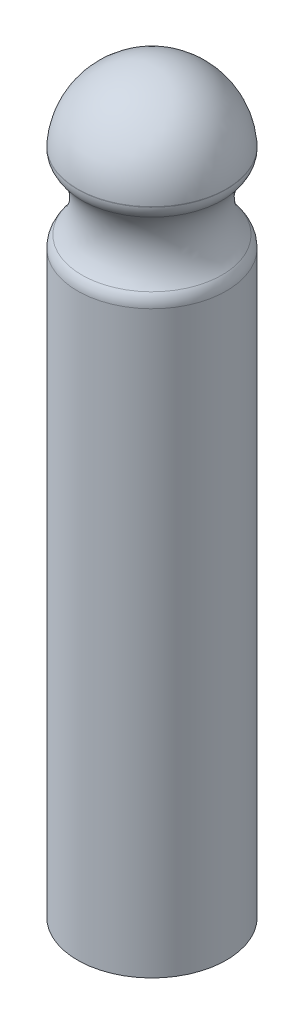
from build123d import *


with BuildPart() as part:
    # Sketch2 → Revolve1 (revolve)
    with BuildSketch(Plane.XY, mode=Mode.PRIVATE) as revolve1_sk:
        with BuildLine():
            Line((0, 0), (6.24, 0))
            Line((6.24, 0), (6.24, 48.588483168))
            ThreePointArc((6.24, 48.588483168), (6.146561159, 49.109622023), (5.877885725, 49.565834731))
            ThreePointArc((5.877885725, 49.565834731), (4.874570596, 52.273796489), (5.877885725, 54.981758248))
            ThreePointArc((5.877885725, 54.981758248), (6.146561159, 55.437970955), (6.24, 55.95910981))
            Line((6.24, 55.95910981), (6.24, 55.998530254))
            ThreePointArc((6.24, 55.998530254), (4.278763618, 60.161301491), (0, 61.854610207))
            Line((0, 61.854610207), (0, 0))
        make_face()
    revolve(revolve1_sk.sketch.rotate(Axis((0, 61.854610207, 0), (0, -1, 0)), 180), axis=Axis((0, 61.854610207, 0), (0, -1, 0)))


solid = part.part
